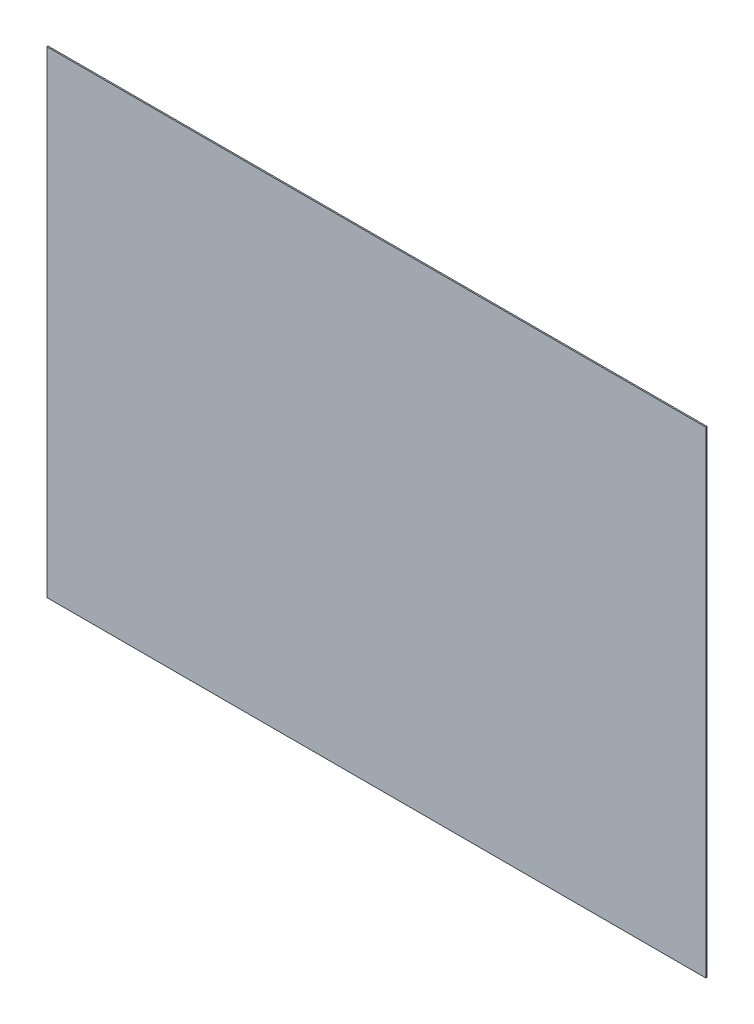
from build123d import *

# Parameters (mm, degrees)
CROQUIS1_W              = 1519.3
CROQUIS1_H              = 1100
SALIENTE_EXTRUIR1_DEPTH = 2.9


with BuildPart() as part:
    # Croquis1 → Saliente-Extruir1 (new body)
    with BuildSketch(Plane.XY):
        with Locations((759.65, -550)):
            Rectangle(CROQUIS1_W, CROQUIS1_H)
    extrude(amount=SALIENTE_EXTRUIR1_DEPTH)


solid = part.part
